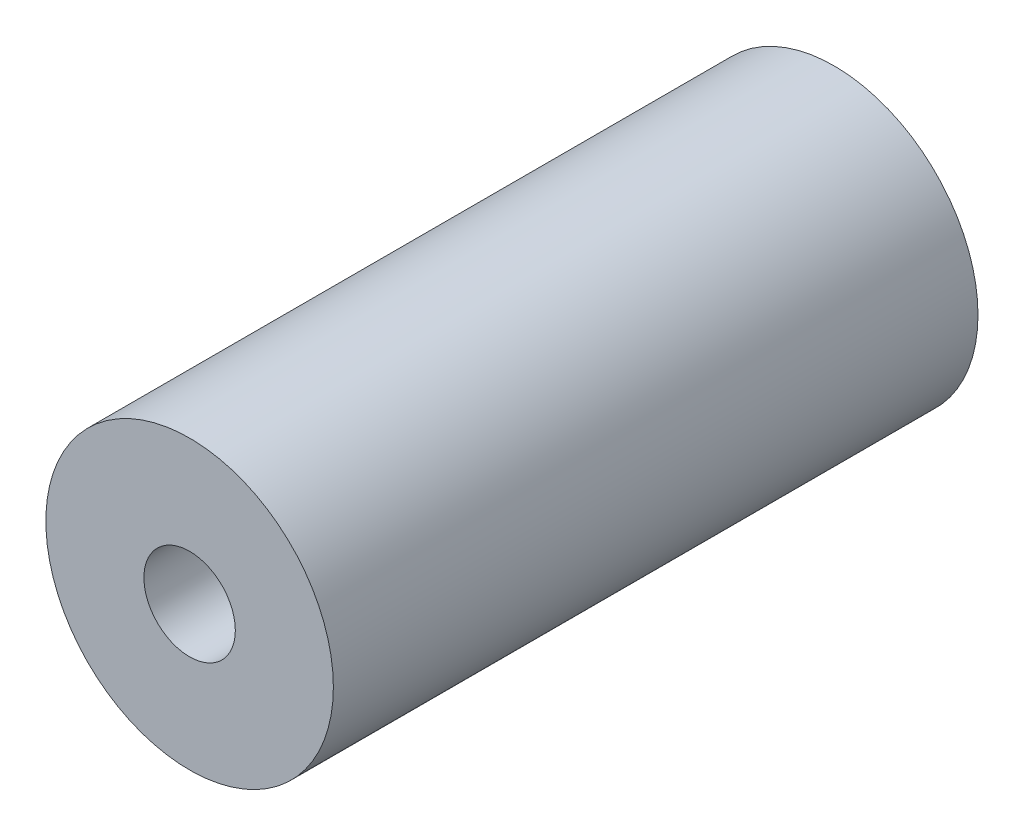
from build123d import *

# Parameters (mm, degrees)
SKETCH1_R                  = 6.35
BOSS_EXTRUDE1_DEPTH        = 28.4734
F_10_32_TAPPED_HOLE2_D     = 4.0386
F_10_32_TAPPED_HOLE2_DEPTH = 9.906
F_10_32_TAPPED_HOLE2_TIP   = 1.213317848
F_10_32_TAPPED_HOLE1_D     = 4.0386
F_10_32_TAPPED_HOLE1_DEPTH = 11.938
F_10_32_TAPPED_HOLE1_TIP   = 1.213317848


with BuildPart() as part:
    # Sketch1 → Boss-Extrude1 (new body)
    with BuildSketch(Plane.XY):
        Circle(SKETCH1_R)
    extrude(amount=BOSS_EXTRUDE1_DEPTH)

    # #10-32 Tapped Hole2
    with Locations(Plane.XY.offset(28.4734)):
        with Locations((0, 0)):
            Hole(F_10_32_TAPPED_HOLE2_D / 2, depth=F_10_32_TAPPED_HOLE2_DEPTH)
            with Locations((0, 0, -(F_10_32_TAPPED_HOLE2_DEPTH + F_10_32_TAPPED_HOLE2_TIP / 2))):  # 118° drill point
                Cone(0, F_10_32_TAPPED_HOLE2_D / 2, F_10_32_TAPPED_HOLE2_TIP, mode=Mode.SUBTRACT)

    # #10-32 Tapped Hole1
    with Locations(Plane(origin=(0, 0, 0), x_dir=(-1, 0, 0), z_dir=(0, 0, -1))):
        with Locations((0, 0)):
            Hole(F_10_32_TAPPED_HOLE1_D / 2, depth=F_10_32_TAPPED_HOLE1_DEPTH)
            with Locations((0, 0, -(F_10_32_TAPPED_HOLE1_DEPTH + F_10_32_TAPPED_HOLE1_TIP / 2))):  # 118° drill point
                Cone(0, F_10_32_TAPPED_HOLE1_D / 2, F_10_32_TAPPED_HOLE1_TIP, mode=Mode.SUBTRACT)


solid = part.part
